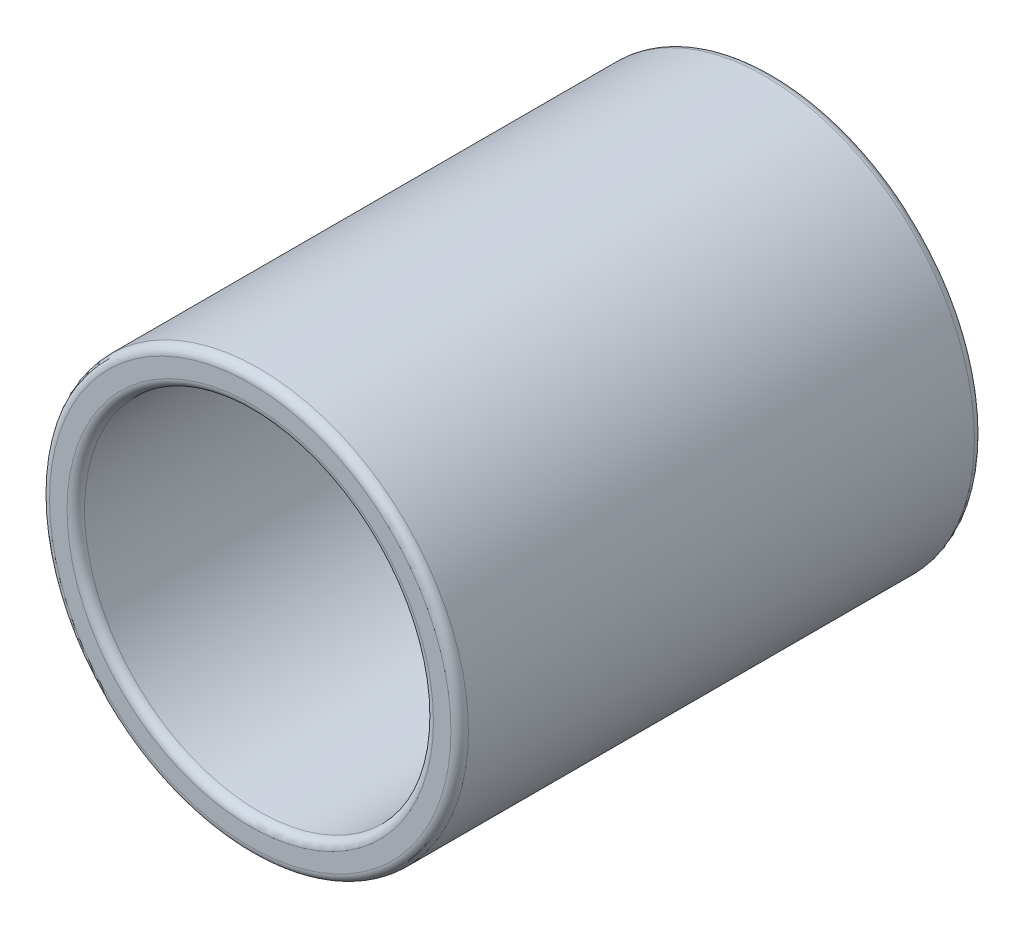
from build123d import *

# Parameters (mm, degrees)
ESQUISSE1_R          = 12
ESQUISSE1_R_2        = 10
BASE_EXTRUSION_DEPTH = 30
CONG_1_R             = 0.5


with BuildPart() as part:
    # Esquisse1 → Base-Extrusion (new body)
    with BuildSketch(Plane.XY):
        Circle(ESQUISSE1_R)
        Circle(ESQUISSE1_R_2, mode=Mode.SUBTRACT)
    extrude(amount=BASE_EXTRUSION_DEPTH)

    # Congé1
    cong_1_edges = [part.edges().sort_by_distance(p)[0] for p in [
        (-12, 0, 0),
        (-12, 0, 30),
        (-10, 0, 0),
        (-10, 0, 30),
    ]]
    fillet(cong_1_edges, radius=CONG_1_R)


solid = part.part
